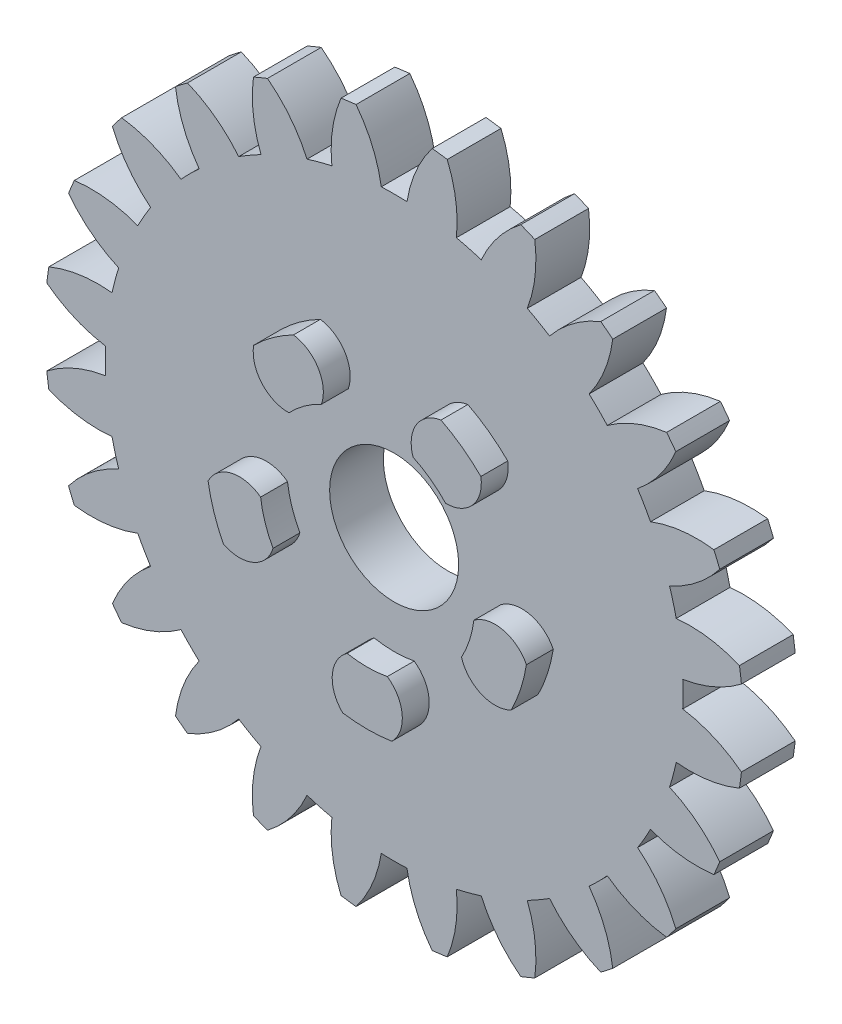
from build123d import *

# Parameters (mm, degrees)
SKETCH1_R           = 3
BOSS_EXTRUDE1_DEPTH = 5
CUT_EXTRUDE1_REACH  = 47.961
SKETCH2_R           = 6
BOSS_EXTRUDE2_DEPTH = 2.5


with BuildPart() as part:
    # Sketch1 → Boss-Extrude1 (new body)
    with BuildSketch(Plane.XY):
        with BuildLine():
            ThreePointArc((-32.30645721, 3.541584753), (-29.724355705, 2.025732467), (-26.847359877, 1.196304146))
            ThreePointArc((-26.847359877, 1.196304146), (-26.874, 0), (-26.847359877, -1.196304146))
            ThreePointArc((-26.847359877, -1.196304146), (-29.724355705, -2.025732467), (-32.30645721, -3.541584753))
            ThreePointArc((-32.30645721, -3.541584753), (-32.221957995, -4.242101247), (-32.122270959, -4.940618226))
            ThreePointArc((-32.122270959, -4.940618226), (-29.235820988, -5.736522053), (-26.24218457, -5.793066977))
            ThreePointArc((-26.24218457, -5.793066977), (-25.958290656, -6.955503018), (-25.622931977, -8.104149117))
            ThreePointArc((-25.622931977, -8.104149117), (-28.187224703, -9.649936667), (-30.289011791, -11.782434585))
            ThreePointArc((-30.289011791, -11.782434585), (-30.026084807, -12.437211552), (-29.749005026, -13.086126239))
            ThreePointArc((-29.749005026, -13.086126239), (-26.754913385, -13.107842075), (-23.848647751, -12.387650158))
            ThreePointArc((-23.848647751, -12.387650158), (-23.273566701, -13.437), (-22.652343606, -14.459709719))
            ThreePointArc((-22.652343606, -14.459709719), (-24.729180918, -16.61651363), (-26.207420273, -19.220330971))
            ThreePointArc((-26.207420273, -19.220330971), (-25.783983559, -19.784746443), (-25.348393564, -20.339836374))
            ThreePointArc((-25.348393564, -20.339836374), (-22.45070265, -19.585884321), (-19.829865, -18.138035453))
            ThreePointArc((-19.829865, -18.138035453), (-19.002787638, -19.002787638), (-18.138035453, -19.829865))
            ThreePointArc((-18.138035453, -19.829865), (-19.585884321, -22.45070265), (-20.339836374, -25.348393564))
            ThreePointArc((-20.339836374, -25.348393564), (-19.784746443, -25.783983559), (-19.220330971, -26.207420273))
            ThreePointArc((-19.220330971, -26.207420273), (-16.61651363, -24.729180918), (-14.459709719, -22.652343606))
            ThreePointArc((-14.459709719, -22.652343606), (-13.437, -23.273566701), (-12.387650158, -23.848647751))
            ThreePointArc((-12.387650158, -23.848647751), (-13.107842075, -26.754913385), (-13.086126239, -29.749005026))
            ThreePointArc((-13.086126239, -29.749005026), (-12.437211552, -30.026084807), (-11.782434585, -30.289011791))
            ThreePointArc((-11.782434585, -30.289011791), (-9.649936667, -28.187224703), (-8.104149117, -25.622931977))
            ThreePointArc((-8.104149117, -25.622931977), (-6.955503018, -25.958290656), (-5.793066977, -26.24218457))
            ThreePointArc((-5.793066977, -26.24218457), (-5.736522053, -29.235820988), (-4.940618226, -32.122270959))
            ThreePointArc((-4.940618226, -32.122270959), (-4.242101247, -32.221957995), (-3.541584753, -32.30645721))
            ThreePointArc((-3.541584753, -32.30645721), (-2.025732467, -29.724355705), (-1.196304146, -26.847359877))
            ThreePointArc((-1.196304146, -26.847359877), (0, -26.874), (1.196304146, -26.847359877))
            ThreePointArc((1.196304146, -26.847359877), (2.025732467, -29.724355705), (3.541584753, -32.30645721))
            ThreePointArc((3.541584753, -32.30645721), (4.242101247, -32.221957995), (4.940618226, -32.122270959))
            ThreePointArc((4.940618226, -32.122270959), (5.736522053, -29.235820988), (5.793066977, -26.24218457))
            ThreePointArc((5.793066977, -26.24218457), (6.955503018, -25.958290656), (8.104149117, -25.622931977))
            ThreePointArc((8.104149117, -25.622931977), (9.649936667, -28.187224703), (11.782434585, -30.289011791))
            ThreePointArc((11.782434585, -30.289011791), (12.437211552, -30.026084807), (13.086126239, -29.749005026))
            ThreePointArc((13.086126239, -29.749005026), (13.107842075, -26.754913385), (12.387650158, -23.848647751))
            ThreePointArc((12.387650158, -23.848647751), (13.437, -23.273566701), (14.459709719, -22.652343606))
            ThreePointArc((14.459709719, -22.652343606), (16.61651363, -24.729180918), (19.220330971, -26.207420273))
            ThreePointArc((19.220330971, -26.207420273), (19.784746443, -25.783983559), (20.339836374, -25.348393564))
            ThreePointArc((20.339836374, -25.348393564), (19.585884321, -22.45070265), (18.138035453, -19.829865))
            ThreePointArc((18.138035453, -19.829865), (19.002787638, -19.002787638), (19.829865, -18.138035453))
            ThreePointArc((19.829865, -18.138035453), (22.45070265, -19.585884321), (25.348393564, -20.339836374))
            ThreePointArc((25.348393564, -20.339836374), (25.783983559, -19.784746443), (26.207420273, -19.220330971))
            ThreePointArc((26.207420273, -19.220330971), (24.729180918, -16.61651363), (22.652343606, -14.459709719))
            ThreePointArc((22.652343606, -14.459709719), (23.273566701, -13.437), (23.848647751, -12.387650158))
            ThreePointArc((23.848647751, -12.387650158), (26.754913385, -13.107842075), (29.749005026, -13.086126239))
            ThreePointArc((29.749005026, -13.086126239), (30.026084807, -12.437211552), (30.289011791, -11.782434585))
            ThreePointArc((30.289011791, -11.782434585), (28.187224703, -9.649936667), (25.622931977, -8.104149117))
            ThreePointArc((25.622931977, -8.104149117), (25.958290656, -6.955503018), (26.24218457, -5.793066977))
            ThreePointArc((26.24218457, -5.793066977), (29.235820988, -5.736522053), (32.122270959, -4.940618226))
            ThreePointArc((32.122270959, -4.940618226), (32.221957995, -4.242101247), (32.30645721, -3.541584753))
            ThreePointArc((32.30645721, -3.541584753), (29.724355705, -2.025732467), (26.847359877, -1.196304146))
            ThreePointArc((26.847359877, -1.196304146), (26.874, 0), (26.847359877, 1.196304146))
            ThreePointArc((26.847359877, 1.196304146), (29.724355705, 2.025732467), (32.30645721, 3.541584753))
            ThreePointArc((32.30645721, 3.541584753), (32.221957995, 4.242101247), (32.122270959, 4.940618226))
            ThreePointArc((32.122270959, 4.940618226), (29.235820988, 5.736522053), (26.24218457, 5.793066977))
            ThreePointArc((26.24218457, 5.793066977), (25.958290656, 6.955503018), (25.622931977, 8.104149117))
            ThreePointArc((25.622931977, 8.104149117), (28.187224703, 9.649936667), (30.289011791, 11.782434585))
            ThreePointArc((30.289011791, 11.782434585), (30.026084807, 12.437211552), (29.749005026, 13.086126239))
            ThreePointArc((29.749005026, 13.086126239), (26.754913385, 13.107842075), (23.848647751, 12.387650158))
            ThreePointArc((23.848647751, 12.387650158), (23.273566701, 13.437), (22.652343606, 14.459709719))
            ThreePointArc((22.652343606, 14.459709719), (24.729180918, 16.61651363), (26.207420273, 19.220330971))
            ThreePointArc((26.207420273, 19.220330971), (25.783983559, 19.784746443), (25.348393564, 20.339836374))
            ThreePointArc((25.348393564, 20.339836374), (22.45070265, 19.585884321), (19.829865, 18.138035453))
            ThreePointArc((19.829865, 18.138035453), (19.002787638, 19.002787638), (18.138035453, 19.829865))
            ThreePointArc((18.138035453, 19.829865), (19.585884321, 22.45070265), (20.339836374, 25.348393564))
            ThreePointArc((20.339836374, 25.348393564), (19.784746443, 25.783983559), (19.220330971, 26.207420273))
            ThreePointArc((19.220330971, 26.207420273), (16.61651363, 24.729180918), (14.459709719, 22.652343606))
            ThreePointArc((14.459709719, 22.652343606), (13.437, 23.273566701), (12.387650158, 23.848647751))
            ThreePointArc((12.387650158, 23.848647751), (13.107842075, 26.754913385), (13.086126239, 29.749005026))
            ThreePointArc((13.086126239, 29.749005026), (12.437211552, 30.026084807), (11.782434585, 30.289011791))
            ThreePointArc((11.782434585, 30.289011791), (9.649936667, 28.187224703), (8.104149117, 25.622931977))
            ThreePointArc((8.104149117, 25.622931977), (6.955503018, 25.958290656), (5.793066977, 26.24218457))
            ThreePointArc((5.793066977, 26.24218457), (5.736522053, 29.235820988), (4.940618226, 32.122270959))
            ThreePointArc((4.940618226, 32.122270959), (4.242101247, 32.221957995), (3.541584753, 32.30645721))
            ThreePointArc((3.541584753, 32.30645721), (2.025732467, 29.724355705), (1.196304146, 26.847359877))
            ThreePointArc((1.196304146, 26.847359877), (0, 26.874), (-1.196304146, 26.847359877))
            ThreePointArc((-1.196304146, 26.847359877), (-2.025732467, 29.724355705), (-3.541584753, 32.30645721))
            ThreePointArc((-3.541584753, 32.30645721), (-4.242101247, 32.221957995), (-4.940618226, 32.122270959))
            ThreePointArc((-4.940618226, 32.122270959), (-5.736522053, 29.235820988), (-5.793066977, 26.24218457))
            ThreePointArc((-5.793066977, 26.24218457), (-6.955503018, 25.958290656), (-8.104149117, 25.622931977))
            ThreePointArc((-8.104149117, 25.622931977), (-9.649936667, 28.187224703), (-11.782434585, 30.289011791))
            ThreePointArc((-11.782434585, 30.289011791), (-12.437211552, 30.026084807), (-13.086126239, 29.749005026))
            ThreePointArc((-13.086126239, 29.749005026), (-13.107842075, 26.754913385), (-12.387650158, 23.848647751))
            ThreePointArc((-12.387650158, 23.848647751), (-13.437, 23.273566701), (-14.459709719, 22.652343606))
            ThreePointArc((-14.459709719, 22.652343606), (-16.61651363, 24.729180918), (-19.220330971, 26.207420273))
            ThreePointArc((-19.220330971, 26.207420273), (-19.784746443, 25.783983559), (-20.339836374, 25.348393564))
            ThreePointArc((-20.339836374, 25.348393564), (-19.585884321, 22.45070265), (-18.138035453, 19.829865))
            ThreePointArc((-18.138035453, 19.829865), (-19.002787638, 19.002787638), (-19.829865, 18.138035453))
            ThreePointArc((-19.829865, 18.138035453), (-22.45070265, 19.585884321), (-25.348393564, 20.339836374))
            ThreePointArc((-25.348393564, 20.339836374), (-25.783983559, 19.784746443), (-26.207420273, 19.220330971))
            ThreePointArc((-26.207420273, 19.220330971), (-24.729180918, 16.61651363), (-22.652343606, 14.459709719))
            ThreePointArc((-22.652343606, 14.459709719), (-23.273566701, 13.437), (-23.848647751, 12.387650158))
            ThreePointArc((-23.848647751, 12.387650158), (-26.754913385, 13.107842075), (-29.749005026, 13.086126239))
            ThreePointArc((-29.749005026, 13.086126239), (-30.026084807, 12.437211552), (-30.289011791, 11.782434585))
            ThreePointArc((-30.289011791, 11.782434585), (-28.187224703, 9.649936667), (-25.622931977, 8.104149117))
            ThreePointArc((-25.622931977, 8.104149117), (-25.958290656, 6.955503018), (-26.24218457, 5.793066977))
            ThreePointArc((-26.24218457, 5.793066977), (-29.235820988, 5.736522053), (-32.122270959, 4.940618226))
            ThreePointArc((-32.122270959, 4.940618226), (-32.221957995, 4.242101247), (-32.30645721, 3.541584753))
        make_face()
        Circle(SKETCH1_R, mode=Mode.SUBTRACT)
    extrude(amount=BOSS_EXTRUDE1_DEPTH)

    # Sketch2 → Cut-Extrude1 (cut, up to next)
    with BuildSketch(Plane(origin=(0, 0, 0), x_dir=(-1, 0, 0), z_dir=(0, 0, -1)), mode=Mode.PRIVATE) as cut_extrude1_sk1:
        Circle(SKETCH2_R)
    cut_extrude1_tool1 = extrude(cut_extrude1_sk1.sketch, amount=-CUT_EXTRUDE1_REACH, mode=Mode.PRIVATE) & part.part
    add(cut_extrude1_tool1.solids().sort_by_distance((0, 0, 0))[0], mode=Mode.SUBTRACT)

    # Sketch3 → Boss-Extrude2 (add)
    with BuildSketch(Plane.XY.offset(5)):
        with BuildLine():
            ThreePointArc((-10.566508613, 10.64654384), (-8.816778784, 12.135254916), (-6.860234162, 13.339309849))
            ThreePointArc((-6.860234162, 13.339309849), (-4.555045267, 11.801322916), (-4.263597916, 9.045536624))
            ThreePointArc((-4.263597916, 9.045536624), (-5.877852523, 8.090169944), (-7.285292336, 6.850147121))
            ThreePointArc((-7.285292336, 6.850147121), (-9.816138662, 7.97891482), (-10.566508613, 10.64654384))
        make_face()
        with BuildLine():
            ThreePointArc((6.860234162, 13.339309849), (8.816778784, 12.135254916), (10.566508613, 10.64654384))
            ThreePointArc((10.566508613, 10.64654384), (9.816138662, 7.97891482), (7.285292336, 6.850147121))
            ThreePointArc((7.285292336, 6.850147121), (5.877852523, 8.090169944), (4.263597916, 9.045536624))
            ThreePointArc((4.263597916, 9.045536624), (4.555045267, 11.801322916), (6.860234162, 13.339309849))
        make_face()
        with BuildLine():
            ThreePointArc((-9.920340763, -1.259698041), (-9.510565163, -3.090169944), (-8.766156198, -4.811912875))
            ThreePointArc((-8.766156198, -4.811912875), (-10.621752599, -6.870082363), (-13.390695627, -6.759383893))
            ThreePointArc((-13.390695627, -6.759383893), (-14.265847744, -4.635254916), (-14.806366496, -2.402396967))
            ThreePointArc((-14.806366496, -2.402396967), (-12.631311458, -0.685296146), (-9.920340763, -1.259698041))
        make_face()
        with BuildLine():
            ThreePointArc((2.290603582, -14.824072829), (0, -15), (-2.290603582, -14.824072829))
            ThreePointArc((-2.290603582, -14.824072829), (-3.251534536, -12.224859227), (-1.867509855, -9.824072829))
            ThreePointArc((-1.867509855, -9.824072829), (0, -10), (1.867509855, -9.824072829))
            ThreePointArc((1.867509855, -9.824072829), (3.251534536, -12.224859227), (2.290603582, -14.824072829))
        make_face()
        with BuildLine():
            ThreePointArc((14.806366496, -2.402396967), (14.265847744, -4.635254916), (13.390695627, -6.759383893))
            ThreePointArc((13.390695627, -6.759383893), (10.621752599, -6.870082363), (8.766156198, -4.811912875))
            ThreePointArc((8.766156198, -4.811912875), (9.510565163, -3.090169944), (9.920340763, -1.259698041))
            ThreePointArc((9.920340763, -1.259698041), (12.631311458, -0.685296146), (14.806366496, -2.402396967))
        make_face()
    extrude(amount=BOSS_EXTRUDE2_DEPTH)


solid = part.part
